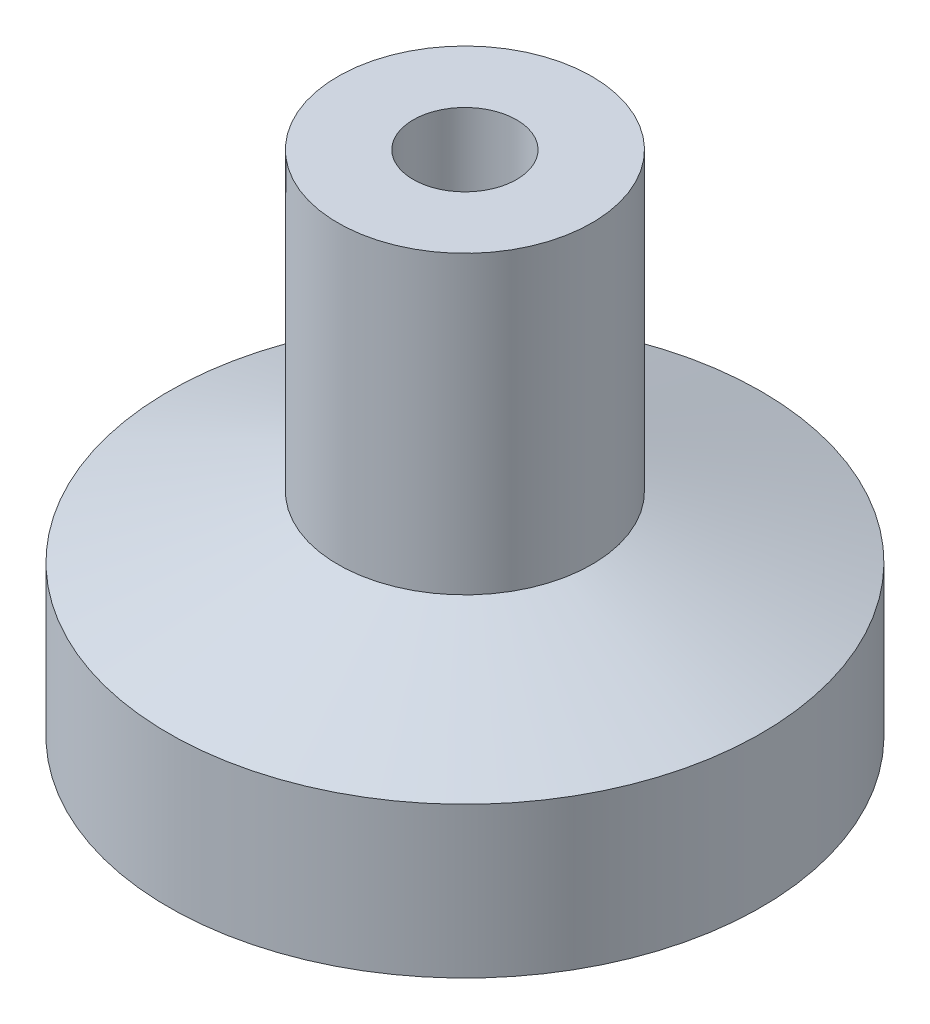
from build123d import *


with BuildPart() as part:
    # Sketch1 → Revolve1 (revolve)
    with BuildSketch(Plane.XY, mode=Mode.PRIVATE) as revolve1_sk:
        Polygon((-2.75, 0), (-15.75, 0), (-15.75, 8), (-6.75, 11.275732108), (-6.75, 27), (-2.75, 27), align=None)
    revolve(revolve1_sk.sketch.rotate(Axis((0, 0, 0), (0, 1, 0)), 270), axis=Axis((0, 0, 0), (0, 1, 0)))


solid = part.part
